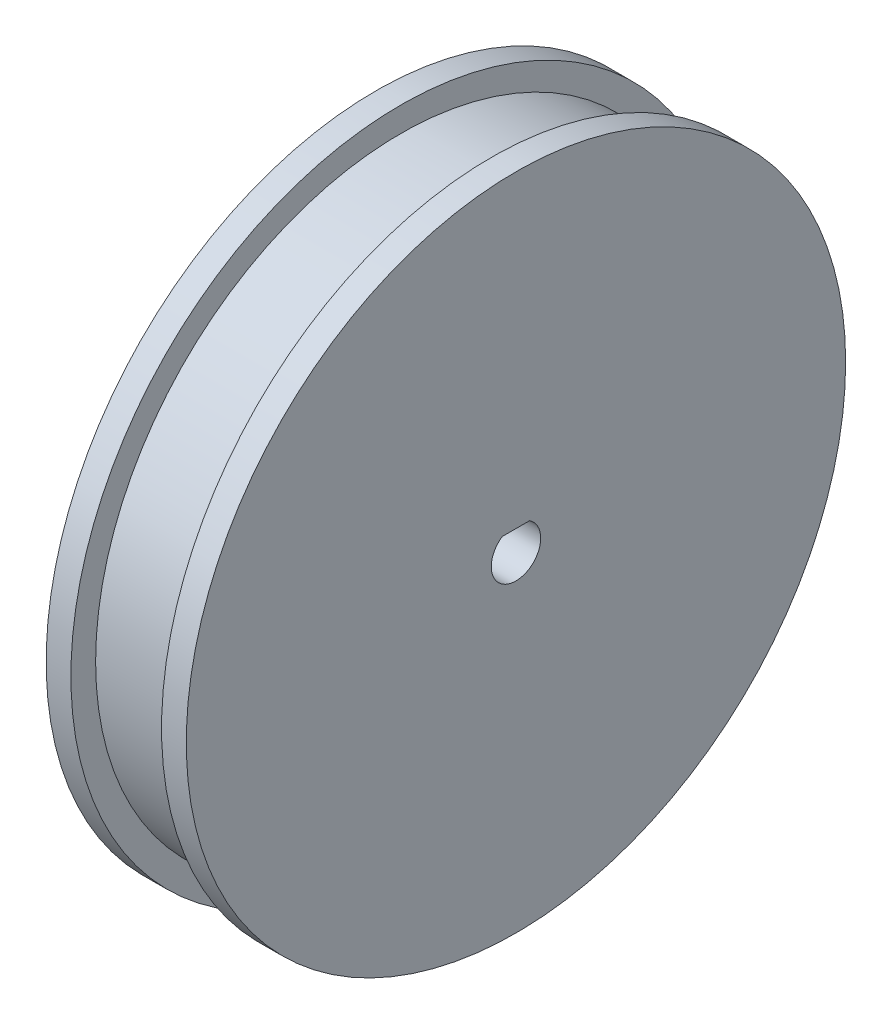
from build123d import *

# Parameters (mm, degrees)
BASE_DEPTH           = 12
BASE_DEPTH_BACK      = 5
ESQUISSE1_R          = 40
VIDE_PNEU_DEPTH      = 9
VIDE_PNEU_DEPTH_BACK = 2
ESQUISSE4_R          = 40
ESQUISSE4_R_2        = 37


with BuildPart() as part:
    # Esquisse1 → BASE (new, two sides: drawn at the far end of the back side and taken through both)
    with BuildSketch(Plane(origin=(0, 0, 0), x_dir=(0, 0, -1), z_dir=(1, 0, 0)).offset(-BASE_DEPTH_BACK)):
        Circle(ESQUISSE1_R)
        with BuildLine():
            Line((-1.658312395, 2.5), (1.658312395, 2.5))
            ThreePointArc((1.658312395, 2.5), (0, -3), (-1.658312395, 2.5))
        make_face(mode=Mode.SUBTRACT)
    extrude(amount=BASE_DEPTH + BASE_DEPTH_BACK)

    # Esquisse4 → VIDE PNEU (cut, two sides: drawn at the far end of the back side and taken through both)
    with BuildSketch(Plane(origin=(0, 0, 0), x_dir=(0, 0, -1), z_dir=(1, 0, 0)).offset(-VIDE_PNEU_DEPTH_BACK)):
        Circle(ESQUISSE4_R)
        Circle(ESQUISSE4_R_2, mode=Mode.SUBTRACT)
    extrude(amount=VIDE_PNEU_DEPTH + VIDE_PNEU_DEPTH_BACK, mode=Mode.SUBTRACT)


solid = part.part
